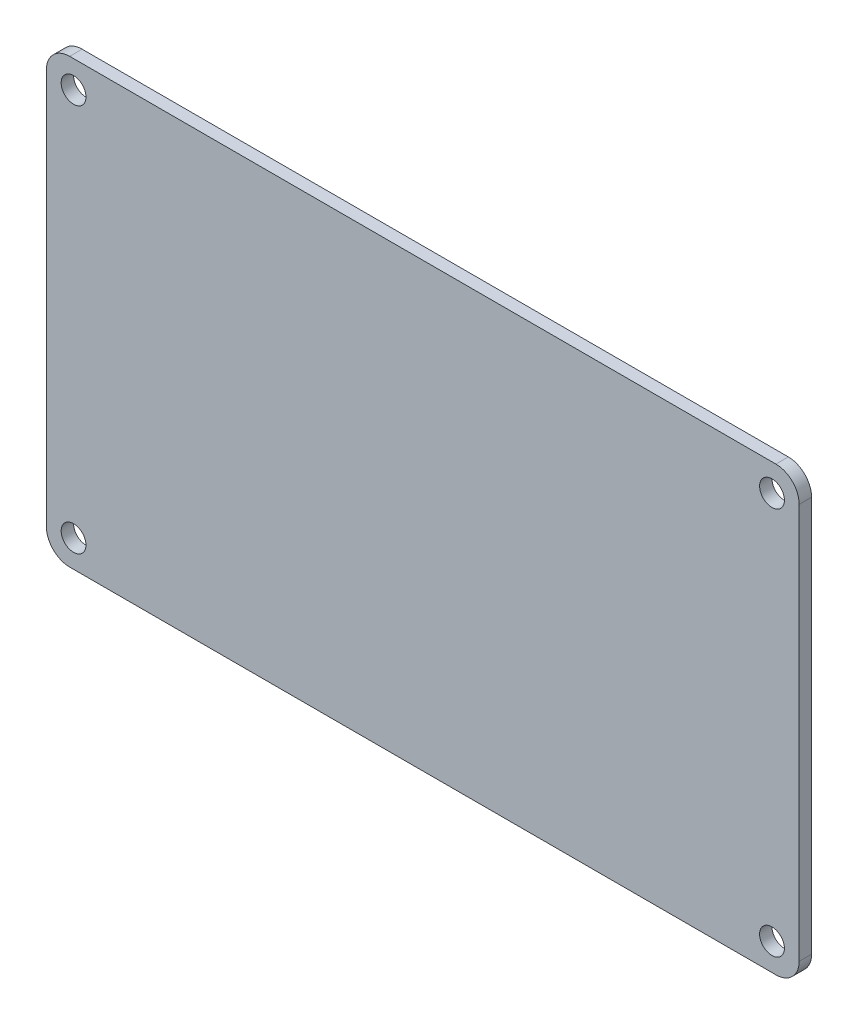
from build123d import *

# Parameters (mm, degrees)
SKETCH1_R           = 1.6
BOSS_EXTRUDE1_DEPTH = 1.6


with BuildPart() as part:
    # Sketch1 → Boss-Extrude1 (new body)
    with BuildSketch(Plane.XY):
        with BuildLine():
            Line((12.268936352, 8.567968161), (103.268936352, 8.567968161))
            ThreePointArc((103.268936352, 8.567968161), (105.390256695, 9.446647817), (106.268936352, 11.567968161))
            Line((106.268936352, 11.567968161), (106.268936352, 62.567968161))
            ThreePointArc((106.268936352, 62.567968161), (105.390256695, 64.689288504), (103.268936352, 65.567968161))
            Line((103.268936352, 65.567968161), (12.268936352, 65.567968161))
            ThreePointArc((12.268936352, 65.567968161), (10.147616008, 64.689288504), (9.268936352, 62.567968161))
            Line((9.268936352, 62.567968161), (9.268936352, 11.567968161))
            ThreePointArc((9.268936352, 11.567968161), (10.147616008, 9.446647817), (12.268936352, 8.567968161))
        make_face()
        with Locations((12.768936352, 12.067968161)):
            Circle(SKETCH1_R, mode=Mode.SUBTRACT)
        with Locations((12.768936352, 62.067968161)):
            Circle(SKETCH1_R, mode=Mode.SUBTRACT)
        with Locations((102.768936352, 62.067968161)):
            Circle(SKETCH1_R, mode=Mode.SUBTRACT)
        with Locations((102.768936352, 12.067968161)):
            Circle(SKETCH1_R, mode=Mode.SUBTRACT)
    extrude(amount=BOSS_EXTRUDE1_DEPTH)


solid = part.part
